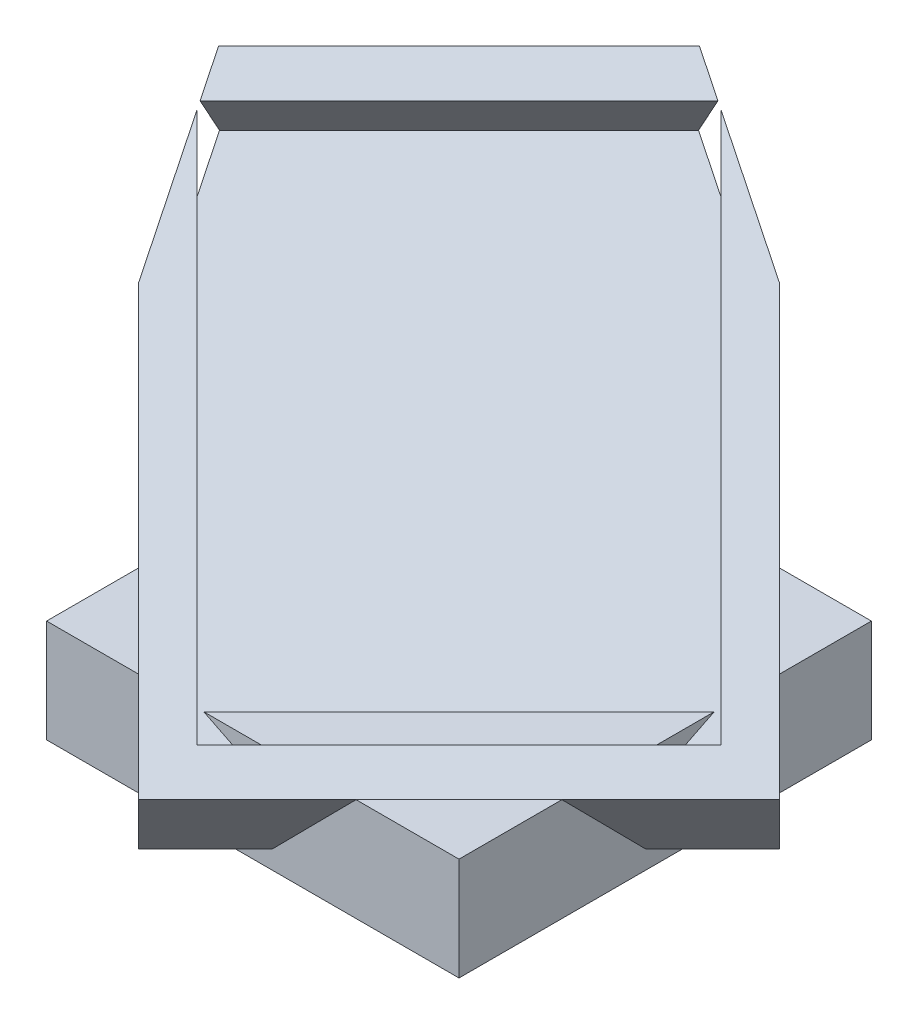
from build123d import *

# Parameters (mm, degrees)
BOSS_EXTRUDE1_DEPTH      = 2.5
BOSS_EXTRUDE2_DEPTH      = 5
BOSS_EXTRUDE3_DEPTH      = 2.5
SKETCH7_W                = 22
SKETCH7_H                = 27.5
SKETCH7_W_2              = 18
SKETCH7_H_2              = 23.5
BOSS_EXTRUDE4_DEPTH      = 5
M2_CLEARANCE_HOLE1_D     = 2.4
M2_CLEARANCE_HOLE1_DEPTH = 7.5
BOSS_EXTRUDE5_DEPTH      = 2
CUT_EXTRUDE5_DEPTH       = 42.382841321


with BuildPart() as part:
    # Sketch1 → Boss-Extrude1 (new body)
    with BuildSketch(Plane(origin=(0, 0, 0), x_dir=(1, 0, 0), z_dir=(0, 1, 0))):
        with BuildLine():
            Line((0, -2.5), (0, -18.03))
            Line((0, -18.03), (18.03, -18.03))
            Line((18.03, -18.03), (18.03, 0))
            Line((18.03, 0), (2.5, 0))
            ThreePointArc((2.5, 0), (1.767766953, -1.767766953), (0, -2.5))
        make_face()
    extrude(amount=BOSS_EXTRUDE1_DEPTH)

    # Sketch2 → Boss-Extrude2 (add)
    with BuildSketch(Plane(origin=(0, 2.5, 0), x_dir=(1, 0, 0), z_dir=(0, 1, 0))):
        Polygon((0, -20.03), (0, -18.03), (18.03, -18.03), (18.03, 0), (20.03, 0), (20.03, -20.03), align=None)
    extrude(amount=-BOSS_EXTRUDE2_DEPTH)

    # Sketch3 → Boss-Extrude3 (add)
    with BuildSketch(Plane(origin=(0, 2.5, 0), x_dir=(1, 0, 0), z_dir=(0, 1, 0))):
        with BuildLine():
            Line((0.855050358, 2.349231552), (7.309511, 0))
            Line((7.309511, 0), (0, -7.309511))
            Line((0, -7.309511), (-2.349231552, -0.855050358))
            ThreePointArc((-2.349231552, -0.855050358), (-1.767766953, 1.767766953), (0.855050358, 2.349231552))
        make_face()
    extrude(amount=BOSS_EXTRUDE3_DEPTH)

    # Sketch7 → Boss-Extrude4 (add)
    with BuildSketch(Plane(origin=(6.597772224, 13.325561997, 6.597772224), x_dir=(0.7071067811865464, 0, -0.7071067811865488), z_dir=(0.40557978767264036, 0.819152044288991, 0.40557978767263897))):
        with Locations((0, -5.123791374)):
            Rectangle(SKETCH7_W, SKETCH7_H)
        with Locations((0, -5.123791374)):
            Rectangle(SKETCH7_W_2, SKETCH7_H_2, mode=Mode.SUBTRACT)
    extrude(amount=-BOSS_EXTRUDE4_DEPTH)

    # M2 Clearance Hole1
    with Locations(Plane(origin=(0, 5, 0), x_dir=(1, 0, 0), z_dir=(0, 1, 0))):
        with Locations((0, 0)):
            Hole(M2_CLEARANCE_HOLE1_D / 2, depth=M2_CLEARANCE_HOLE1_DEPTH)

    # Sketch10 → Boss-Extrude5 (add)
    with BuildSketch(Plane(origin=(4.569873286, 9.229801775, 4.569873286), x_dir=(0.9117676909005845, -0.3311545099281039, -0.24293284747866747), z_dir=(-0.40557978767264047, -0.8191520442889909, -0.40557978767263886))):
        Polygon((-13.961806263, -0.692416888), (1.91532614, 21.761239087), (19.878250921, 9.059533165), (4.001118518, -13.394122811), align=None)
    extrude(amount=-BOSS_EXTRUDE5_DEPTH)

    # Sketch13 → Cut-Extrude5 (cut, through all)
    with BuildSketch(Plane(origin=(0, 18.273352, 0), x_dir=(1, 0, 0), z_dir=(0, 1, 0))):
        Polygon((-8.346263934, -7.351506608), (-1.070246696, -14.627523847), (-5.52058621, -4.525828883), align=None)
        Polygon((7.351506608, 8.346263934), (14.627523847, 1.070246696), (4.525828883, 5.52058621), align=None)
    extrude(amount=-CUT_EXTRUDE5_DEPTH, mode=Mode.SUBTRACT)


solid = part.part
